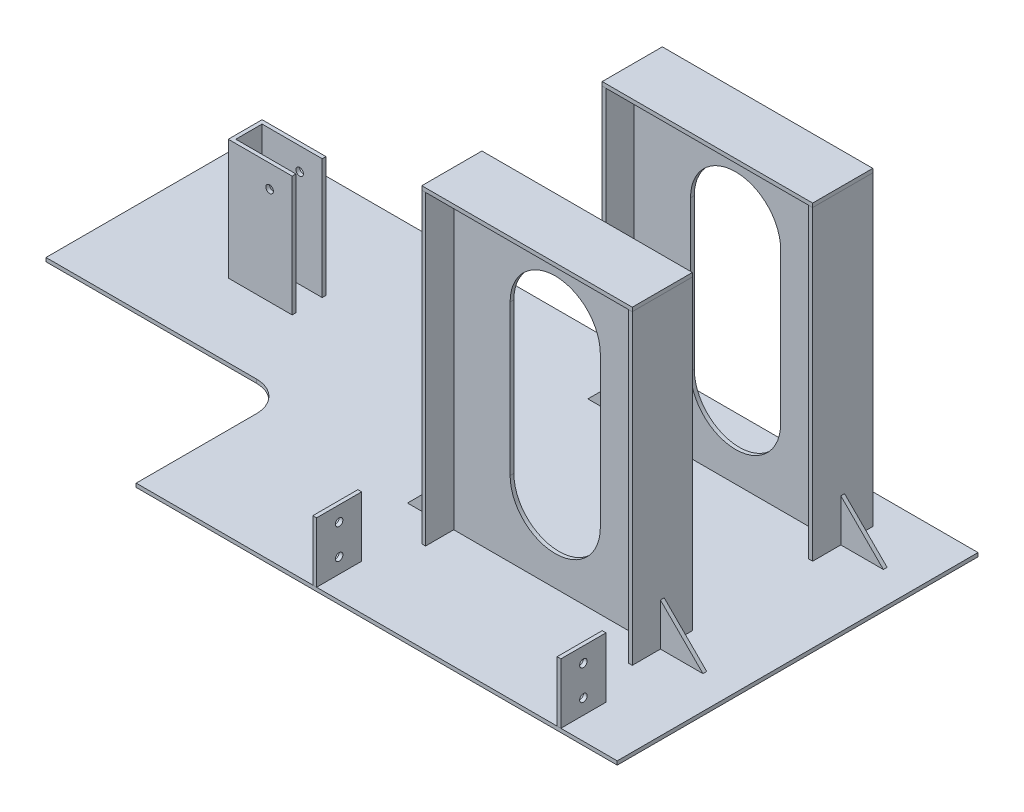
from build123d import *

# Parameters (mm, degrees)
SKETCH2_W           = 609.6
SKETCH2_H           = 304.8
BOSS_EXTRUDE1_DEPTH = 3.175
SKETCH3_W           = 50.8
SKETCH3_H           = 258.7625
BOSS_EXTRUDE2_DEPTH = 3.302
SKETCH6_W           = 50.8
SKETCH6_H           = 258.7625
BOSS_EXTRUDE5_DEPTH = 3.175
SKETCH4_W           = 177.8
SKETCH4_H           = 50.8
BOSS_EXTRUDE3_DEPTH = 3.302
SKETCH5_W           = 171.323
SKETCH5_H           = 258.7625
BOSS_EXTRUDE4_DEPTH = 1.5875
SKETCH8_W           = 50.8
SKETCH8_H           = 101.6
SKETCH8_R           = 3.175
BOSS_EXTRUDE6_DEPTH = 1.5875
SKETCH9_W           = 28.575
SKETCH9_H           = 101.6
BOSS_EXTRUDE7_DEPTH = 3.175
BOSS_EXTRUDE8_DEPTH = 1.5875
CUT_EXTRUDE1_DEPTH  = 566.373825284
CUT_EXTRUDE2_DEPTH  = 575.428065262
SKETCH13_W          = 38.1
SKETCH13_H          = 50.8
SKETCH13_R          = 3.175
BOSS_EXTRUDE9_DEPTH = 3.175


with BuildPart() as part:
    # Sketch2 → Boss-Extrude1 (new body)
    with BuildSketch(Plane(origin=(0, 0, 0), x_dir=(1, 0, 0), z_dir=(0, 1, 0))):
        with Locations((-152.4, -76.2)):
            Rectangle(SKETCH2_W, SKETCH2_H)
    extrude(amount=-BOSS_EXTRUDE1_DEPTH)



with BuildPart() as body_2:
    # Sketch3 → Boss-Extrude2 (new body)
    with BuildSketch(Plane(origin=(88.9, 0, 0), x_dir=(0, 0, -1), z_dir=(1, 0, 0))):
        with Locations((-127, 129.38125)):
            Rectangle(SKETCH3_W, SKETCH3_H)
    extrude(amount=-BOSS_EXTRUDE2_DEPTH)


with BuildPart() as body_3:
    # Sketch6 → Boss-Extrude5 (new body)
    with BuildSketch(Plane(origin=(-88.9, 0, 0), x_dir=(0, 0, -1), z_dir=(1, 0, 0))):
        with Locations((-127, 129.38125)):
            Rectangle(SKETCH6_W, SKETCH6_H)
    extrude(amount=BOSS_EXTRUDE5_DEPTH)


with BuildPart() as body_4:
    # Sketch4 → Boss-Extrude3 (new body)
    with BuildSketch(Plane(origin=(0, 258.7625, 0), x_dir=(1, 0, 0), z_dir=(0, 1, 0))):
        with Locations((0, -127)):
            Rectangle(SKETCH4_W, SKETCH4_H)
    extrude(amount=BOSS_EXTRUDE3_DEPTH)


with BuildPart() as body_5:
    # Sketch5 → Boss-Extrude4 (new, symmetric)
    with BuildSketch(Plane.XY.offset(127)):
        with Locations((-0.0635, 129.38125)):
            Rectangle(SKETCH5_W, SKETCH5_H)
    extrude(amount=BOSS_EXTRUDE4_DEPTH, both=True)


with BuildPart() as body_6:
    # Mirror4: mirrored copy
    add(body_5.part.mirror(Plane.XY.offset(50.8)))


with BuildPart() as body_7:
    # Mirror4 2: mirrored copy
    add(body_2.part.mirror(Plane.XY.offset(50.8)))


with BuildPart() as body_8:
    # Mirror4 3: mirrored copy
    add(body_4.part.mirror(Plane.XY.offset(50.8)))


with BuildPart() as body_9:
    # Mirror4 4: mirrored copy
    add(body_3.part.mirror(Plane.XY.offset(50.8)))


with BuildPart() as body_10:
    # Sketch8 → Boss-Extrude6 (new, symmetric)
    with BuildSketch(Plane.XY.offset(38.1)):
        with Locations((-336.55, 50.8)):
            Rectangle(SKETCH8_W, SKETCH8_H)
        with Locations((-330.2, 82.55)):
            Circle(SKETCH8_R, mode=Mode.SUBTRACT)
    extrude(amount=BOSS_EXTRUDE6_DEPTH, both=True)


with BuildPart() as body_11:
    # Mirror5: mirrored copy
    add(body_10.part.mirror(Plane.XY.offset(25.4)))


with BuildPart() as part_1:
    add(part.part)

    add(body_10.part)  # Boss-Extrude7 merges body 10

    add(body_11.part)  # Boss-Extrude7 merges body 11
    # Sketch9 → Boss-Extrude7 (add)
    with BuildSketch(Plane.ZY.offset(361.95)):
        with Locations((25.4, 50.8)):
            Rectangle(SKETCH9_W, SKETCH9_H)
    extrude(amount=BOSS_EXTRUDE7_DEPTH)

    # Sketch12 → Cut-Extrude2 (cut, through all)
    with BuildSketch(Plane(origin=(0, 0, 0), x_dir=(1, 0, 0), z_dir=(0, 1, 0))):
        with BuildLine():
            Line((-457.2, -228.6), (-254, -228.6))
            Line((-254, -228.6), (-254, -127))
            ThreePointArc((-254, -127), (-261.439487758, -109.039487758), (-279.4, -101.6))
            Line((-279.4, -101.6), (-457.2, -101.6))
            Line((-457.2, -101.6), (-457.2, -228.6))
        make_face()
    extrude(amount=-CUT_EXTRUDE2_DEPTH, mode=Mode.SUBTRACT)


with BuildPart() as body_10_2:
    # Sketch10 → Boss-Extrude8 (new, symmetric)
    with BuildSketch(Plane.XY.offset(127)):
        Polygon((88.9, 35.921024484), (124.821024484, 0), (88.9, 0), align=None)
    extrude(amount=BOSS_EXTRUDE8_DEPTH, both=True)


with BuildPart() as body_11_2:
    # Mirror6: mirrored copy
    add(body_10_2.part.mirror(Plane.XY.offset(50.8)))


with BuildPart() as body_12:
    # Mirror7: mirrored copy
    add(body_10_2.part.mirror(Plane(origin=(0, 0, 0), x_dir=(0, 0, 1), z_dir=(1, 0, 0))))


with BuildPart() as body_13:
    # Mirror7 2: mirrored copy
    add(body_11_2.part.mirror(Plane(origin=(0, 0, 0), x_dir=(0, 0, 1), z_dir=(1, 0, 0))))


with BuildPart() as cut_extrude1_tool:
    # Sketch11 → Cut-Extrude1 (new, through all)
    with BuildSketch(Plane.XY.offset(128.5875)):
        with BuildLine():
            Line((-38.1, 63.5), (-38.1, 190.5))
            ThreePointArc((-38.1, 190.5), (0, 228.6), (38.1, 190.5))
            Line((38.1, 190.5), (38.1, 63.5))
            ThreePointArc((38.1, 63.5), (0, 25.4), (-38.1, 63.5))
        make_face()
    extrude(amount=-CUT_EXTRUDE1_DEPTH)


with BuildPart() as body_5_1:
    add(body_5.part)

    # Cut-Extrude1: cut by cut_extrude1_tool
    add(cut_extrude1_tool.part, mode=Mode.SUBTRACT)


with BuildPart() as body_6_1:
    add(body_6.part)

    # Cut-Extrude1: cut by cut_extrude1_tool
    add(cut_extrude1_tool.part, mode=Mode.SUBTRACT)


with BuildPart() as body_14:
    # Sketch13 → Boss-Extrude9 (new body)
    with BuildSketch(Plane(origin=(101.6, 0, 0), x_dir=(0, 0, -1), z_dir=(1, 0, 0))):
        with Locations((-209.55, 25.4)):
            Rectangle(SKETCH13_W, SKETCH13_H)
        with Locations((-209.55, 38.1)):
            Circle(SKETCH13_R, mode=Mode.SUBTRACT)
        with Locations((-209.55, 12.7)):
            Circle(SKETCH13_R, mode=Mode.SUBTRACT)
    extrude(amount=BOSS_EXTRUDE9_DEPTH)


with BuildPart() as body_15:
    # Mirror8: mirrored copy
    add(body_14.part.mirror(Plane(origin=(0, 0, 0), x_dir=(0, 0, 1), z_dir=(1, 0, 0))))


solid = Compound([body_2.part, body_3.part, body_4.part, body_7.part, body_8.part, body_9.part, part_1.part, body_10_2.part, body_11_2.part, body_12.part, body_13.part, body_5_1.part, body_6_1.part, body_14.part, body_15.part])
